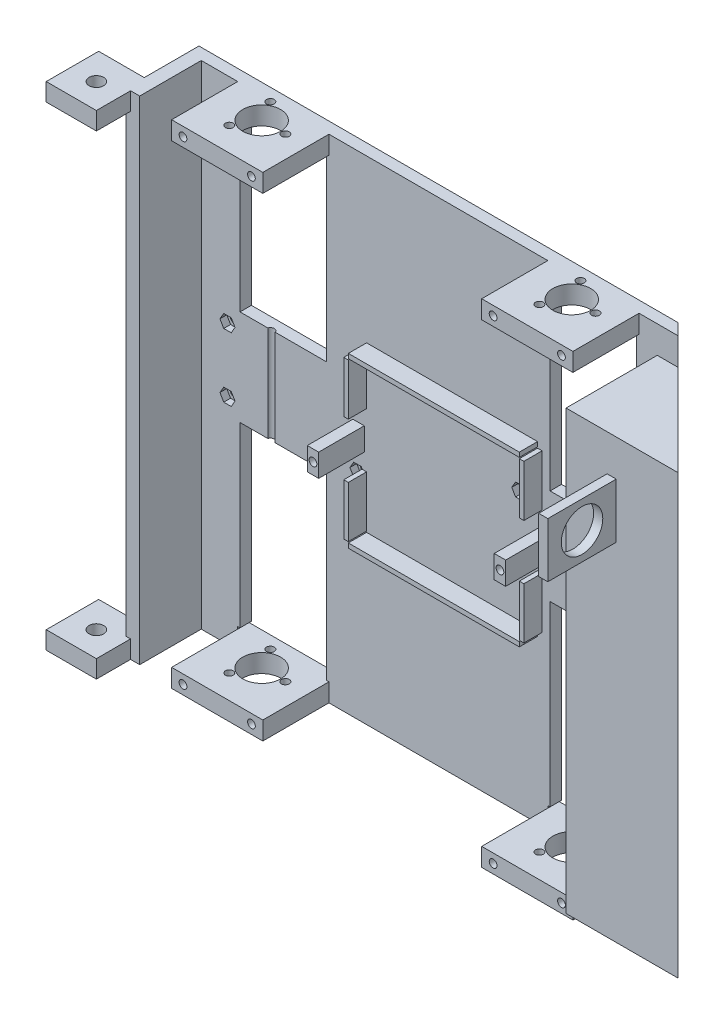
from build123d import *

# Parameters (mm, degrees)
LOWER_DECK_5MM_Z18_START                        = 18
SKETCH_1_W                                      = 220
SKETCH_1_H                                      = 216
LOWER_DECK_5MM_Z18_DEPTH                        = 5
FOUR_RECESSES_FOR_ACTUAL_MOTOR_BODIES_START     = 40
SKETCH_2_W                                      = 38
SKETCH_2_H                                      = 78
FOUR_RECESSES_FOR_ACTUAL_MOTOR_BODIES_DEPTH     = 30
INTEGRAL_MOTOR_SEATS_1_START                    = -108
SKETCH_3_W                                      = 40
SKETCH_3_H                                      = 34
INTEGRAL_MOTOR_SEATS_1_DEPTH                    = 8
INTEGRAL_MOTOR_SEATS_1_START_2                  = 100
SKETCH_4_W                                      = 40
SKETCH_4_H                                      = 34
INTEGRAL_MOTOR_SEATS_1_2_DEPTH                  = 8
COAXIAL_MOTOR_PILOTS_AND_MATCHING_M3_DEPTH      = 110
COAXIAL_MOTOR_PILOTS_AND_MATCHING_M3_DEPTH_BACK = 110
SKETCH_5_R                                      = 8.3
SKETCH_5_R_2                                    = 1.7
EIGHT_DECK_CONNECTION_M3_CLEARANCE_START        = 54
SKETCH_6_R                                      = 1.7
EIGHT_DECK_CONNECTION_M3_CLEARANCE_DEPTH        = 37
MOTOR_FACE_CLEARANCE_TO_FLANGE_DATUM_START      = 23
SKETCH_7_W                                      = 39
SKETCH_7_H                                      = 1
SKETCH_7_W_2                                    = 38
MOTOR_FACE_CLEARANCE_TO_FLANGE_DATUM_DEPTH      = 5
TRIM_REAR_UNDER_RAMP_CONTACT_LINE_DEPTH         = 110
TRIM_REAR_UNDER_RAMP_CONTACT_LINE_DEPTH_BACK    = 110
INTEGRAL45_TAIL_OUTER_DEPTH                     = 96
INTEGRAL45_TAIL_OUTER_DEPTH_BACK                = 96
CLOSED_TAIL_LIGHTWEIGHT_CORE_DEPTH              = 90
CLOSED_TAIL_LIGHTWEIGHT_CORE_DEPTH_BACK         = 90
FULL_WIDTH_FRONT_HARD_STOP_DEPTH                = 108
FULL_WIDTH_FRONT_HARD_STOP_DEPTH_BACK           = 108
SKETCH_12_W                                     = 6
SKETCH_12_H                                     = 32
DIRECT_PIVOT_CHEEK_108_START                    = -108
SKETCH_13_W                                     = 22
SKETCH_13_H                                     = 23
DIRECT_PIVOT_CHEEK_108_DEPTH                    = 7.8
DIRECT_PIVOT_CHEEK_100_2_START                  = 100.2
SKETCH_14_W                                     = 22
SKETCH_14_H                                     = 23
DIRECT_PIVOT_CHEEK_100_2_DEPTH                  = 7.8
M6_PIVOT_COAXIAL_BORES_DEPTH                    = 110
M6_PIVOT_COAXIAL_BORES_DEPTH_BACK               = 110
SKETCH_15_R                                     = 3.2
RECESSED_LOOP_PATCH_65_START                    = -45
SKETCH_16_W                                     = 0.81
SKETCH_16_H                                     = 12
RECESSED_LOOP_PATCH_65_DEPTH                    = 20
RECESSED_LOOP_PATCH_45_START                    = 65
SKETCH_17_W                                     = 0.81
SKETCH_17_H                                     = 12
RECESSED_LOOP_PATCH_45_DEPTH                    = 20
BATTERY_INTEGRAL_CLAMP_POSTS_START              = 23
SKETCH_18_W                                     = 5
SKETCH_18_H                                     = 10
BATTERY_INTEGRAL_CLAMP_POSTS_DEPTH              = 20
BATTERY_SHORT_LATERAL_LOCATORS_START            = 23
SKETCH_19_W                                     = 75
SKETCH_19_H                                     = 2
SKETCH_19_W_2                                   = 2
SKETCH_19_H_2                                   = 22.5
BATTERY_SHORT_LATERAL_LOCATORS_DEPTH            = 8
BATTERY_M3_THROUGH_COLUMNS_START                = 44
SKETCH_20_R                                     = 1.7
BATTERY_M3_THROUGH_COLUMNS_DEPTH                = 27
FOUR_GRAY_MOUNTING_PAIRS_START                  = 24
SKETCH_22_R                                     = 1.7
FOUR_GRAY_MOUNTING_PAIRS_DEPTH                  = 7
GRAY_CAPTIVE_NUTS_TOP_LOADING_START             = 23
GRAY_CAPTIVE_NUTS_TOP_LOADING_DEPTH             = 3
REAR_PHOTOEYE_ON_TAIL_TOP_NOT_CONTACT_RA_START  = 63
SKETCH_24_W                                     = 4
SKETCH_24_H                                     = 24
REAR_PHOTOEYE_ON_TAIL_TOP_NOT_CONTACT_RA_DEPTH  = 30
REAR_M18_CLEARANCE_START                        = 118
SKETCH_25_R                                     = 9.1
REAR_M18_CLEARANCE_DEPTH                        = 4


with BuildPart() as part:
    # 草图1 → Lower_deck_5mm_Z18 (new body)
    with BuildSketch(Plane.XY.offset(LOWER_DECK_5MM_Z18_START)):
        Rectangle(SKETCH_1_W, SKETCH_1_H)
    extrude(amount=LOWER_DECK_5MM_Z18_DEPTH)

    # 草图2 → Four_recesses_for_actual_motor_bodies (cut)
    with BuildSketch(Plane.XY.offset(FOUR_RECESSES_FOR_ACTUAL_MOTOR_BODIES_START)):
        with Locations((-68, -60)):
            Rectangle(SKETCH_2_W, SKETCH_2_H)
        with Locations((-68, 60)):
            Rectangle(SKETCH_2_W, SKETCH_2_H)
        with Locations((68, -60)):
            Rectangle(SKETCH_2_W, SKETCH_2_H)
        with Locations((68, 60)):
            Rectangle(SKETCH_2_W, SKETCH_2_H)
    extrude(amount=-FOUR_RECESSES_FOR_ACTUAL_MOTOR_BODIES_DEPTH, mode=Mode.SUBTRACT)

    # 草图3 → Integral_motor_seats_-1 (add)
    with BuildSketch(Plane(origin=(0, 0, 0), x_dir=(1, 0, 0), z_dir=(0, 1, 0)).offset(INTEGRAL_MOTOR_SEATS_1_START)):
        with Locations((-68, -35)):
            Rectangle(SKETCH_3_W, SKETCH_3_H)
        with Locations((68, -35)):
            Rectangle(SKETCH_3_W, SKETCH_3_H)
    extrude(amount=INTEGRAL_MOTOR_SEATS_1_DEPTH)

    # 草图4 → Integral_motor_seats_1 2 (add)
    with BuildSketch(Plane(origin=(0, 0, 0), x_dir=(1, 0, 0), z_dir=(0, 1, 0)).offset(INTEGRAL_MOTOR_SEATS_1_START_2)):
        with Locations((-68, -35)):
            Rectangle(SKETCH_4_W, SKETCH_4_H)
        with Locations((68, -35)):
            Rectangle(SKETCH_4_W, SKETCH_4_H)
    extrude(amount=INTEGRAL_MOTOR_SEATS_1_2_DEPTH)

    # 草图5 → Coaxial_motor_pilots_and_matching_M3 (cut, two sides: drawn at the far end of the back side and taken through both)
    with BuildSketch(Plane(origin=(0, 0, 0), x_dir=(1, 0, 0), z_dir=(0, 1, 0)).offset(-COAXIAL_MOTOR_PILOTS_AND_MATCHING_M3_DEPTH_BACK)):
        with Locations(Location((-68, -32.5, 0), (0, 0, 90))):
            Circle(SKETCH_5_R)
        with Locations(Location((-73.2, -23.4933358, 0), (0, 0, 90))):
            Circle(SKETCH_5_R_2)
        with Locations(Location((-73.2, -41.5066642, 0), (0, 0, 90))):
            Circle(SKETCH_5_R_2)
        with Locations(Location((-57.6, -32.5, 0), (0, 0, 90))):
            Circle(SKETCH_5_R_2)
        with Locations(Location((68, -32.5, 0), (0, 0, 90))):
            Circle(SKETCH_5_R)
        with Locations(Location((62.8, -23.4933358, 0), (0, 0, 90))):
            Circle(SKETCH_5_R_2)
        with Locations(Location((62.8, -41.5066642, 0), (0, 0, 90))):
            Circle(SKETCH_5_R_2)
        with Locations(Location((78.4, -32.5, 0), (0, 0, 90))):
            Circle(SKETCH_5_R_2)
    extrude(amount=COAXIAL_MOTOR_PILOTS_AND_MATCHING_M3_DEPTH + COAXIAL_MOTOR_PILOTS_AND_MATCHING_M3_DEPTH_BACK, mode=Mode.SUBTRACT)

    # 草图6 → Eight_deck_connection_M3_clearance (cut)
    with BuildSketch(Plane.XY.offset(EIGHT_DECK_CONNECTION_M3_CLEARANCE_START)):
        with Locations(Location((-83, -104, 0), (0, 0, 180))):
            Circle(SKETCH_6_R)
        with Locations(Location((-83, 104, 0), (0, 0, 180))):
            Circle(SKETCH_6_R)
        with Locations(Location((-53, -104, 0), (0, 0, 180))):
            Circle(SKETCH_6_R)
        with Locations(Location((-53, 104, 0), (0, 0, 180))):
            Circle(SKETCH_6_R)
        with Locations(Location((53, -104, 0), (0, 0, 180))):
            Circle(SKETCH_6_R)
        with Locations(Location((53, 104, 0), (0, 0, 180))):
            Circle(SKETCH_6_R)
        with Locations(Location((83, -104, 0), (0, 0, 180))):
            Circle(SKETCH_6_R)
        with Locations(Location((83, 104, 0), (0, 0, 180))):
            Circle(SKETCH_6_R)
    extrude(amount=-EIGHT_DECK_CONNECTION_M3_CLEARANCE_DEPTH, mode=Mode.SUBTRACT)

    # 草图7 → Motor_face_clearance_to_flange_datum (cut)
    with BuildSketch(Plane.XY.offset(MOTOR_FACE_CLEARANCE_TO_FLANGE_DATUM_START)):
        with Locations((-68.5, -99.5)):
            Rectangle(SKETCH_7_W, SKETCH_7_H)
        with Locations((-68, 99.5)):
            Rectangle(SKETCH_7_W_2, SKETCH_7_H)
        with Locations((67.5, -99.5)):
            Rectangle(SKETCH_7_W, SKETCH_7_H)
        with Locations((68, 99.5)):
            Rectangle(SKETCH_7_W_2, SKETCH_7_H)
    extrude(amount=-MOTOR_FACE_CLEARANCE_TO_FLANGE_DATUM_DEPTH, mode=Mode.SUBTRACT)

    # 草图9 → Trim_rear_under_ramp_contact_line (cut, two sides: drawn at the far end of the back side and taken through both)
    with BuildSketch(Plane(origin=(0, 0, 0), x_dir=(1, 0, 0), z_dir=(0, 1, 0)).offset(-TRIM_REAR_UNDER_RAMP_CONTACT_LINE_DEPTH_BACK)):
        Polygon((100, 10), (170, 10), (170, -88), (100, -18), align=None)
    extrude(amount=TRIM_REAR_UNDER_RAMP_CONTACT_LINE_DEPTH + TRIM_REAR_UNDER_RAMP_CONTACT_LINE_DEPTH_BACK, mode=Mode.SUBTRACT)

    # 草图10 → Integral45_tail_outer (add, two sides: drawn at the far end of the back side and taken through both)
    with BuildSketch(Plane(origin=(0, 0, 0), x_dir=(1, 0, 0), z_dir=(0, 1, 0)).offset(-INTEGRAL45_TAIL_OUTER_DEPTH_BACK)):
        Polygon((96, -18), (100, -18), (145, -63), (96, -63), align=None)
    extrude(amount=INTEGRAL45_TAIL_OUTER_DEPTH + INTEGRAL45_TAIL_OUTER_DEPTH_BACK)

    # 草图11 → Closed_tail_lightweight_core (cut, two sides: drawn at the far end of the back side and taken through both)
    with BuildSketch(Plane(origin=(0, 0, 0), x_dir=(1, 0, 0), z_dir=(0, 1, 0)).offset(-CLOSED_TAIL_LIGHTWEIGHT_CORE_DEPTH_BACK)):
        Polygon((101, -26), (101, -57), (132, -57), align=None)
    extrude(amount=CLOSED_TAIL_LIGHTWEIGHT_CORE_DEPTH + CLOSED_TAIL_LIGHTWEIGHT_CORE_DEPTH_BACK, mode=Mode.SUBTRACT)

    # 草图12 → Full_width_front_hard_stop (add, two sides: drawn at the far end of the back side and taken through both)
    with BuildSketch(Plane(origin=(0, 0, 0), x_dir=(1, 0, 0), z_dir=(0, 1, 0)).offset(-FULL_WIDTH_FRONT_HARD_STOP_DEPTH_BACK)):
        with Locations((-107, -34)):
            Rectangle(SKETCH_12_W, SKETCH_12_H)
    extrude(amount=FULL_WIDTH_FRONT_HARD_STOP_DEPTH + FULL_WIDTH_FRONT_HARD_STOP_DEPTH_BACK)

    # 草图13 → Direct_pivot_cheek_-108 (add)
    with BuildSketch(Plane(origin=(0, 0, 0), x_dir=(1, 0, 0), z_dir=(0, 1, 0)).offset(DIRECT_PIVOT_CHEEK_108_START)):
        with Locations((-119, -53.5)):
            Rectangle(SKETCH_13_W, SKETCH_13_H)
    extrude(amount=DIRECT_PIVOT_CHEEK_108_DEPTH)

    # 草图14 → Direct_pivot_cheek_100.2 (add)
    with BuildSketch(Plane(origin=(0, 0, 0), x_dir=(1, 0, 0), z_dir=(0, 1, 0)).offset(DIRECT_PIVOT_CHEEK_100_2_START)):
        with Locations((-119, -53.5)):
            Rectangle(SKETCH_14_W, SKETCH_14_H)
    extrude(amount=DIRECT_PIVOT_CHEEK_100_2_DEPTH)

    # 草图15 → M6_pivot_coaxial_bores (cut, two sides: drawn at the far end of the back side and taken through both)
    with BuildSketch(Plane(origin=(0, 0, 0), x_dir=(1, 0, 0), z_dir=(0, 1, 0)).offset(-M6_PIVOT_COAXIAL_BORES_DEPTH_BACK)):
        with Locations(Location((-119, -54, 0), (0, 0, 90))):
            Circle(SKETCH_15_R)
    extrude(amount=M6_PIVOT_COAXIAL_BORES_DEPTH + M6_PIVOT_COAXIAL_BORES_DEPTH_BACK, mode=Mode.SUBTRACT)

    # 草图16 → Recessed_loop_patch_-65 (cut)
    with BuildSketch(Plane(origin=(0, 0, 0), x_dir=(1, 0, 0), z_dir=(0, 1, 0)).offset(RECESSED_LOOP_PATCH_65_START)):
        with Locations((-109.605, -32)):
            Rectangle(SKETCH_16_W, SKETCH_16_H)
    extrude(amount=-RECESSED_LOOP_PATCH_65_DEPTH, mode=Mode.SUBTRACT)

    # 草图17 → Recessed_loop_patch_45 (cut)
    with BuildSketch(Plane(origin=(0, 0, 0), x_dir=(1, 0, 0), z_dir=(0, 1, 0)).offset(RECESSED_LOOP_PATCH_45_START)):
        with Locations((-109.605, -32)):
            Rectangle(SKETCH_17_W, SKETCH_17_H)
    extrude(amount=-RECESSED_LOOP_PATCH_45_DEPTH, mode=Mode.SUBTRACT)

    # 草图18 → Battery_integral_clamp_posts (add)
    with BuildSketch(Plane.XY.offset(BATTERY_INTEGRAL_CLAMP_POSTS_START)):
        with Locations((-35, 0)):
            Rectangle(SKETCH_18_W, SKETCH_18_H)
        with Locations((47, 0)):
            Rectangle(SKETCH_18_W, SKETCH_18_H)
    extrude(amount=BATTERY_INTEGRAL_CLAMP_POSTS_DEPTH)

    # 草图19 → Battery_short_lateral_locators (add)
    with BuildSketch(Plane.XY.offset(BATTERY_SHORT_LATERAL_LOCATORS_START)):
        with Locations((6, -36)):
            Rectangle(SKETCH_19_W, SKETCH_19_H)
        with Locations((6, 36)):
            Rectangle(SKETCH_19_W, SKETCH_19_H)
        with Locations((-32.5, -23.25)):
            Rectangle(SKETCH_19_W_2, SKETCH_19_H_2)
        with Locations((44.5, -23.25)):
            Rectangle(SKETCH_19_W_2, SKETCH_19_H_2)
        with Locations((-32.5, 23.25)):
            Rectangle(SKETCH_19_W_2, SKETCH_19_H_2)
        with Locations((44.5, 23.25)):
            Rectangle(SKETCH_19_W_2, SKETCH_19_H_2)
    extrude(amount=BATTERY_SHORT_LATERAL_LOCATORS_DEPTH)

    # 草图20 → Battery_M3_through_columns (cut)
    with BuildSketch(Plane.XY.offset(BATTERY_M3_THROUGH_COLUMNS_START)):
        with Locations(Location((-35, 0, 0), (0, 0, 180))):
            Circle(SKETCH_20_R)
        with Locations(Location((47, 0, 0), (0, 0, 180))):
            Circle(SKETCH_20_R)
    extrude(amount=-BATTERY_M3_THROUGH_COLUMNS_DEPTH, mode=Mode.SUBTRACT)

    # 草图22 → Four_gray_mounting_pairs (cut)
    with BuildSketch(Plane.XY.offset(FOUR_GRAY_MOUNTING_PAIRS_START)):
        with Locations(Location((-92.5, -14, 0), (0, 0, 180))):
            Circle(SKETCH_22_R)
        with Locations(Location((-92.5, 14, 0), (0, 0, 180))):
            Circle(SKETCH_22_R)
        with Locations(Location((-35.5, -14, 0), (0, 0, 180))):
            Circle(SKETCH_22_R)
        with Locations(Location((-35.5, 14, 0), (0, 0, 180))):
            Circle(SKETCH_22_R)
        with Locations(Location((35.5, -14, 0), (0, 0, 180))):
            Circle(SKETCH_22_R)
        with Locations(Location((35.5, 14, 0), (0, 0, 180))):
            Circle(SKETCH_22_R)
        with Locations(Location((92.5, -14, 0), (0, 0, 180))):
            Circle(SKETCH_22_R)
        with Locations(Location((92.5, 14, 0), (0, 0, 180))):
            Circle(SKETCH_22_R)
    extrude(amount=-FOUR_GRAY_MOUNTING_PAIRS_DEPTH, mode=Mode.SUBTRACT)

    # 草图23 → Gray_captive_nuts_top_loading (cut)
    with BuildSketch(Plane.XY.offset(GRAY_CAPTIVE_NUTS_TOP_LOADING_START)):
        Polygon((-89.2, -14), (-90.85, -11.142116168), (-94.15, -11.142116168), (-95.8, -14), (-94.15, -16.857883832), (-90.85, -16.857883832), align=None)
        Polygon((-89.2, 14), (-90.85, 16.857883832), (-94.15, 16.857883832), (-95.8, 14), (-94.15, 11.142116168), (-90.85, 11.142116168), align=None)
        Polygon((-32.2, -14), (-33.85, -11.142116168), (-37.15, -11.142116168), (-38.8, -14), (-37.15, -16.857883832), (-33.85, -16.857883832), align=None)
        Polygon((-32.2, 14), (-33.85, 16.857883832), (-37.15, 16.857883832), (-38.8, 14), (-37.15, 11.142116168), (-33.85, 11.142116168), align=None)
        Polygon((38.8, -14), (37.15, -11.142116168), (33.85, -11.142116168), (32.2, -14), (33.85, -16.857883832), (37.15, -16.857883832), align=None)
        Polygon((38.8, 14), (37.15, 16.857883832), (33.85, 16.857883832), (32.2, 14), (33.85, 11.142116168), (37.15, 11.142116168), align=None)
        Polygon((95.8, -14), (94.15, -11.142116168), (90.85, -11.142116168), (89.2, -14), (90.85, -16.857883832), (94.15, -16.857883832), align=None)
        Polygon((95.8, 14), (94.15, 16.857883832), (90.85, 16.857883832), (89.2, 14), (90.85, 11.142116168), (94.15, 11.142116168), align=None)
    extrude(amount=-GRAY_CAPTIVE_NUTS_TOP_LOADING_DEPTH, mode=Mode.SUBTRACT)

    # 草图24 → Rear_photoeye_on_tail_top_not_contact_ramp (add)
    with BuildSketch(Plane.XY.offset(REAR_PHOTOEYE_ON_TAIL_TOP_NOT_CONTACT_RA_START)):
        with Locations((116, 68)):
            Rectangle(SKETCH_24_W, SKETCH_24_H)
    extrude(amount=REAR_PHOTOEYE_ON_TAIL_TOP_NOT_CONTACT_RA_DEPTH)

    # 草图25 → Rear_M18_clearance (cut)
    with BuildSketch(Plane(origin=(0, 0, 0), x_dir=(0, 0, -1), z_dir=(1, 0, 0)).offset(REAR_M18_CLEARANCE_START)):
        with Locations((-78, 68)):
            Circle(SKETCH_25_R)
    extrude(amount=-REAR_M18_CLEARANCE_DEPTH, mode=Mode.SUBTRACT)


solid = part.part
